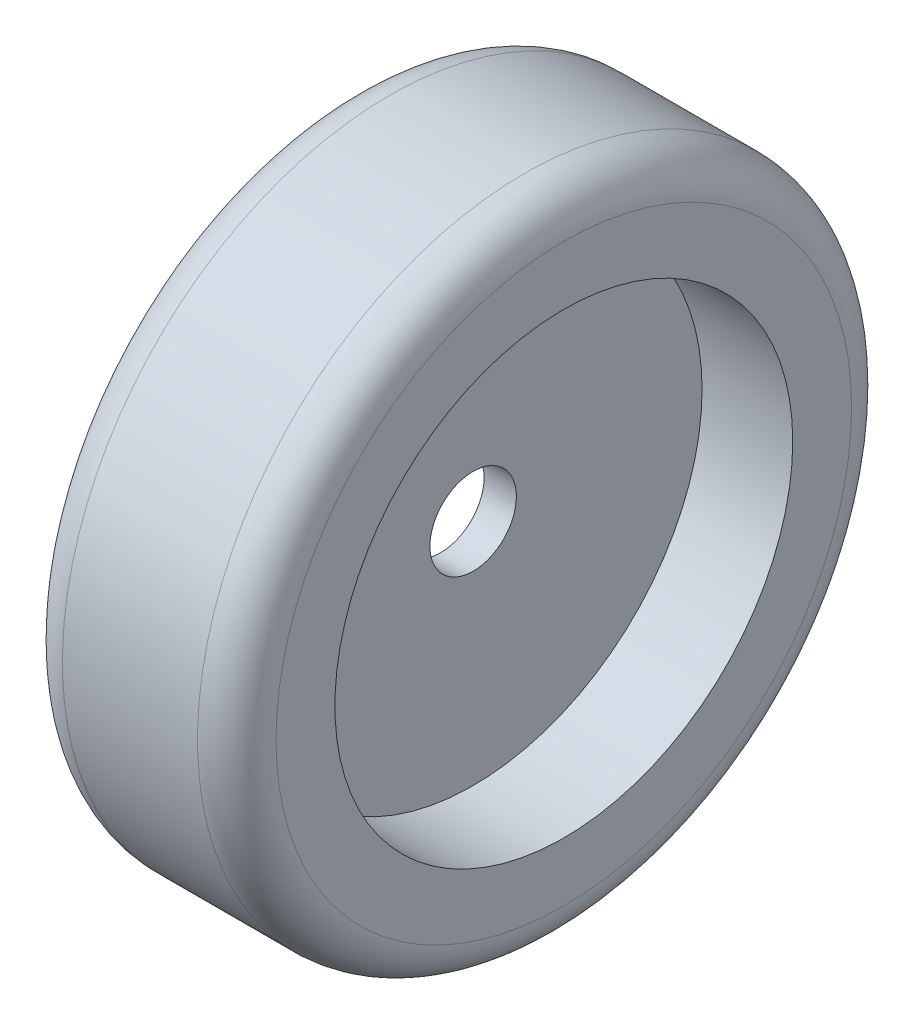
from build123d import *

# Parameters (mm, degrees)
SKETCH1_R           = 127
SKETCH1_R_2         = 16.7894
BOSS_EXTRUDE1_DEPTH = 82.9564
FILLET1_R           = 15.24
CUT_EXTRUDE1_START  = -35.2044
SKETCH2_R           = 88.9
SKETCH2_R_2         = 16.7894
CUT_EXTRUDE1_DEPTH  = 35.2044


with BuildPart() as part:
    # Sketch1 → Boss-Extrude1 (new body)
    with BuildSketch(Plane(origin=(0, 0, 0), x_dir=(0, 0, -1), z_dir=(1, 0, 0))):
        Circle(SKETCH1_R)
        Circle(SKETCH1_R_2, mode=Mode.SUBTRACT)
    extrude(amount=BOSS_EXTRUDE1_DEPTH)

    # Fillet1
    fillet1_edges = [part.edges().sort_by_distance(p)[0] for p in [
        (0, 0, 127),
        (82.9564, 0, 127),
    ]]
    fillet(fillet1_edges, radius=FILLET1_R)

    # Sketch2 → Cut-Extrude1 (cut)
    with BuildSketch(Plane(origin=(82.9564, 0, 0), x_dir=(0, 0, -1), z_dir=(1, 0, 0)).offset(CUT_EXTRUDE1_START)):
        Circle(SKETCH2_R)
        Circle(SKETCH2_R_2, mode=Mode.SUBTRACT)
    cut_extrude1 = extrude(amount=CUT_EXTRUDE1_DEPTH, mode=Mode.SUBTRACT)

    # Mirror1: Cut-Extrude1 across plane
    add(cut_extrude1.mirror(Plane.ZY.offset(-41.4782)), mode=Mode.SUBTRACT)


solid = part.part
